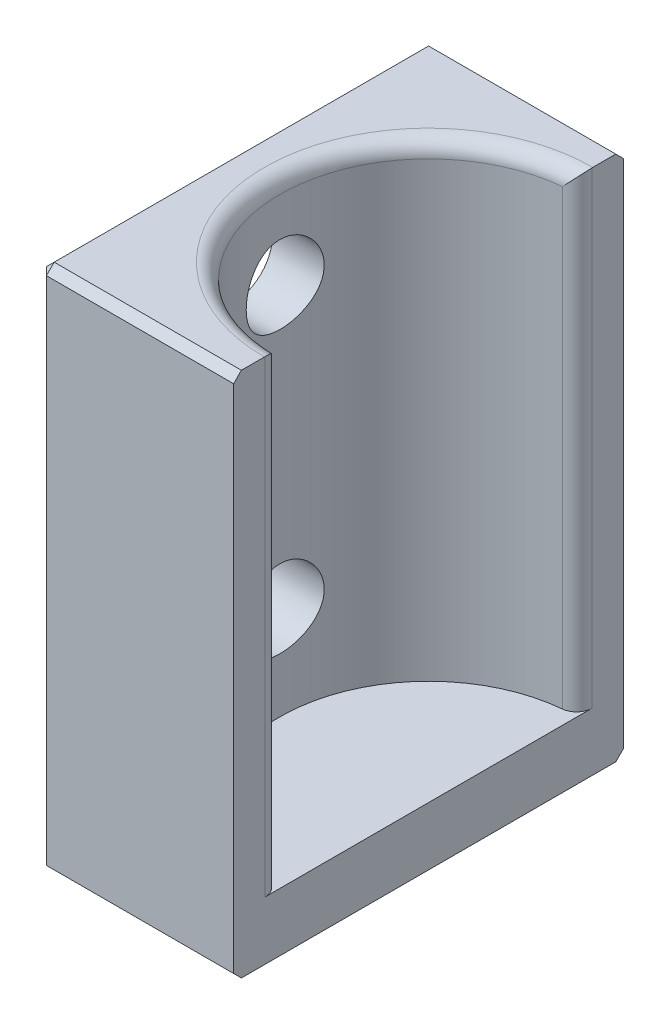
from build123d import *

# Parameters (mm, degrees)
SKETCH1_W           = 25
SKETCH1_H           = 25
BOSS_EXTRUDE1_DEPTH = 33.74
SKETCH2_R           = 9.525
CUT_EXTRUDE1_DEPTH  = 30
SKETCH3_W           = 12.5
SKETCH3_H           = 25
CUT_EXTRUDE2_DEPTH  = 39.090518505
SKETCH4_R           = 2.5
CUT_EXTRUDE3_DEPTH  = 39.090518505
CHAMFER2_SIZE       = 0.5
FILLET1_R           = 1


with BuildPart() as part:
    # Sketch1 → Boss-Extrude1 (new body)
    with BuildSketch(Plane(origin=(0, 0, 0), x_dir=(1, 0, 0), z_dir=(0, 1, 0))):
        Rectangle(SKETCH1_W, SKETCH1_H)
    extrude(amount=BOSS_EXTRUDE1_DEPTH)

    # Sketch2 → Cut-Extrude1 (cut)
    with BuildSketch(Plane(origin=(0, 33.74, 0), x_dir=(1, 0, 0), z_dir=(0, 1, 0))):
        with Locations(Location((0, 0, 0), (0, 0, 270))):
            Circle(SKETCH2_R)
    extrude(amount=-CUT_EXTRUDE1_DEPTH, mode=Mode.SUBTRACT)

    # Sketch3 → Cut-Extrude2 (cut, through all)
    with BuildSketch(Plane(origin=(0, 33.74, 0), x_dir=(1, 0, 0), z_dir=(0, 1, 0))):
        with Locations((6.25, 0)):
            Rectangle(SKETCH3_W, SKETCH3_H)
    extrude(amount=-CUT_EXTRUDE2_DEPTH, mode=Mode.SUBTRACT)

    # Sketch4 → Cut-Extrude3 (cut, through all)
    with BuildSketch(Plane.ZY.offset(12.5)):
        with Locations((0, 27.74)):
            Circle(SKETCH4_R)
        with Locations((0, 9.74)):
            Circle(SKETCH4_R)
    extrude(amount=-CUT_EXTRUDE3_DEPTH, mode=Mode.SUBTRACT)

    # Chamfer2
    chamfer2_edges = [part.edges().sort_by_distance(p)[0] for p in [
        (-12.5, 33.74, 0),
        (-6.25, 33.74, 12.5),
        (-6.25, 0, -12.5),
        (-6.25, 33.74, -12.5),
        (-6.25, 0, 12.5),
        (-12.5, 0, 0),
        (-12.5, 16.87, 12.5),
        (-12.5, 16.87, -12.5),
    ]]
    chamfer(chamfer2_edges, length=CHAMFER2_SIZE)

    # Fillet1
    fillet1_edges = [part.edges().sort_by_distance(p)[0] for p in [
        (-9.525, 33.74, 0),
        (0, 18.74, 9.525),
        (0, 18.74, -9.525),
    ]]
    fillet(fillet1_edges, radius=FILLET1_R)


solid = part.part
